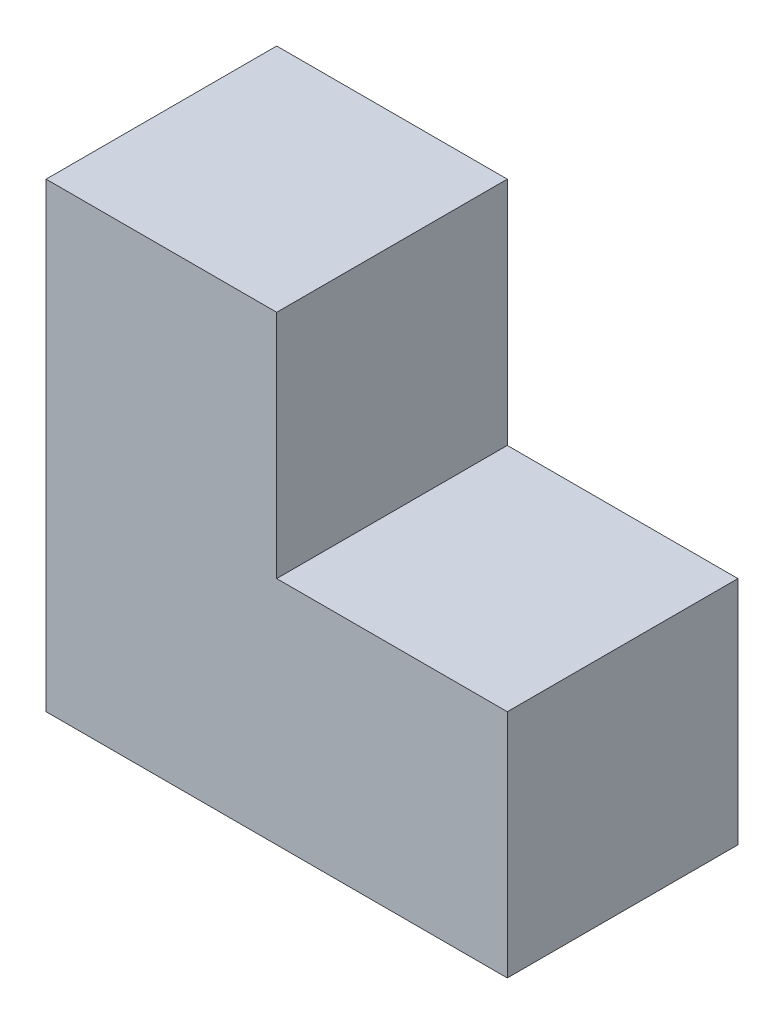
from build123d import *

# Parameters (mm, degrees)
BOSS_EXTRU_1_DEPTH = 10


with BuildPart() as part:
    # Esquisse1 → Boss.-Extru.1 (new body)
    with BuildSketch(Plane.XY):
        Polygon((0, 0), (0, 20), (10, 20), (10, 10), (20, 10), (20, 0), align=None)
    extrude(amount=-BOSS_EXTRU_1_DEPTH)


solid = part.part
